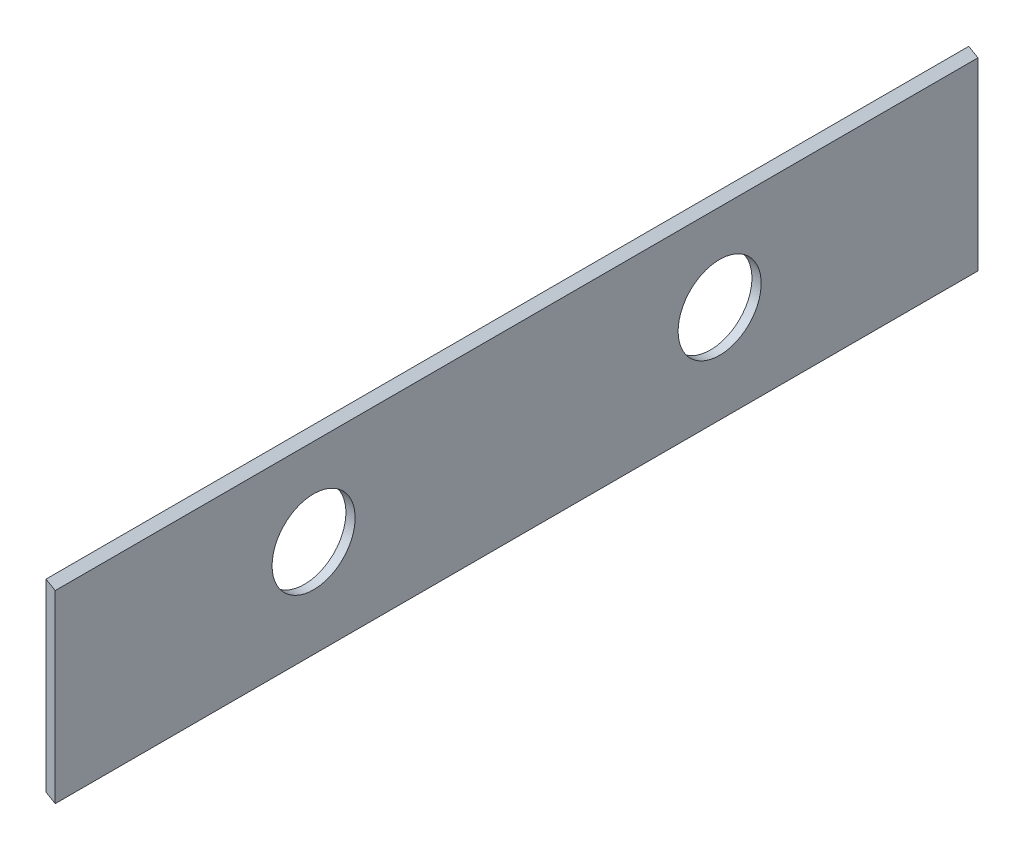
from build123d import *

# Parameters (mm, degrees)
SALIENTE_EXTRUIR2_DEPTH          = 50
TALADRO_DE_MARGEN_PARA_M82_D     = 9
TALADRO_DE_MARGEN_PARA_M82_DEPTH = 10
TALADRO_DE_MARGEN_PARA_M82_TIP   = 2.703872786


with BuildPart() as part:
    # Croquis3 → Saliente-Extruir2 (new, symmetric)
    with BuildSketch(Plane.XY):
        Polygon((0, 0), (0, 20), (-1, 20.577350269), (-1, 0.577350269), align=None)
    extrude(amount=SALIENTE_EXTRUIR2_DEPTH, both=True)

    # Taladro de margen para M82
    with Locations(Plane(origin=(-1, 10.577350269, -22), x_dir=(0, -1, 0), z_dir=(-1, 0, 0))):
        with Locations((0, 0), (0, 44)):
            Hole(TALADRO_DE_MARGEN_PARA_M82_D / 2, depth=TALADRO_DE_MARGEN_PARA_M82_DEPTH)
            with Locations((0, 0, -(TALADRO_DE_MARGEN_PARA_M82_DEPTH + TALADRO_DE_MARGEN_PARA_M82_TIP / 2))):  # 118° drill point
                Cone(0, TALADRO_DE_MARGEN_PARA_M82_D / 2, TALADRO_DE_MARGEN_PARA_M82_TIP, mode=Mode.SUBTRACT)


solid = part.part
